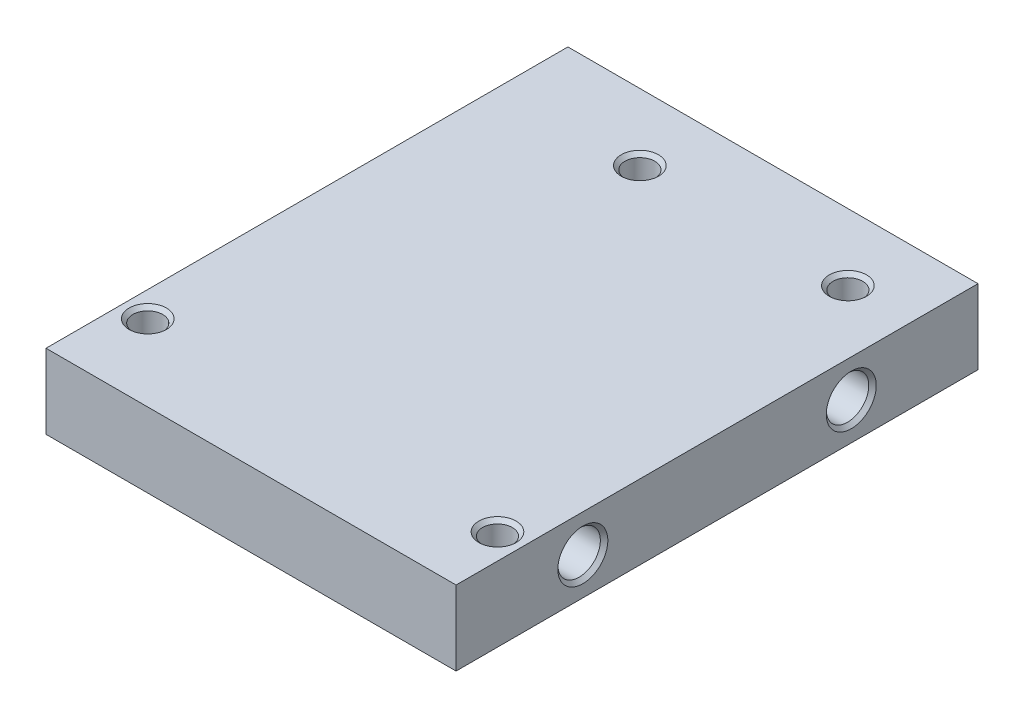
from build123d import *

# Parameters (mm, degrees)
SKETCH1_W           = 55
SKETCH1_H           = 70
SKETCH1_R           = 2
BOSS_EXTRUDE1_DEPTH = 5
SKETCH2_R           = 2.85
CUT_EXTRUDE1_DEPTH  = 8
CHAMFER1_SIZE       = 0.5


with BuildPart() as part:
    # Sketch1 → Boss-Extrude1 (new, symmetric)
    with BuildSketch(Plane(origin=(0, 0, 0), x_dir=(1, 0, 0), z_dir=(0, 1, 0))):
        Rectangle(SKETCH1_W, SKETCH1_H)
        with Locations(Location((24.1, -26.05, 0), (0, 0, 270))):
            Circle(SKETCH1_R, mode=Mode.SUBTRACT)
        with Locations(Location((-24.1, -24.75, 0), (0, 0, 270))):
            Circle(SKETCH1_R, mode=Mode.SUBTRACT)
        with Locations(Location((19, 26.05, 0), (0, 0, 270))):
            Circle(SKETCH1_R, mode=Mode.SUBTRACT)
        with Locations(Location((-8.9, 26.05, 0), (0, 0, 270))):
            Circle(SKETCH1_R, mode=Mode.SUBTRACT)
    extrude(amount=BOSS_EXTRUDE1_DEPTH, both=True)

    # Sketch2 → Cut-Extrude1 (cut)
    with BuildSketch(Plane(origin=(27.5, 0, 0), x_dir=(0, 0, -1), z_dir=(1, 0, 0))):
        with Locations((-18, 0)):
            Circle(SKETCH2_R)
        with Locations(Location((18, 0, 0), (0, 0, 180))):
            Circle(SKETCH2_R)
    cut_extrude1 = extrude(amount=-CUT_EXTRUDE1_DEPTH, mode=Mode.SUBTRACT)

    # Mirror1: Cut-Extrude1 across plane
    add(cut_extrude1.mirror(Plane(origin=(0, 0, 0), x_dir=(0, 0, 1), z_dir=(1, 0, 0))), mode=Mode.SUBTRACT)

    # Chamfer1
    chamfer1_edges = [part.edges().sort_by_distance(p)[0] for p in [
        (-24.1, 5, 22.75),
        (19, 5, -28.05),
        (24.1, 5, 24.05),
        (-8.9, 5, -28.05),
        (27.5, 0, 20.85),
        (27.5, 0, -20.85),
        (-27.5, 0, 20.85),
        (-27.5, 0, -20.85),
    ]]
    chamfer(chamfer1_edges, length=CHAMFER1_SIZE)


solid = part.part
